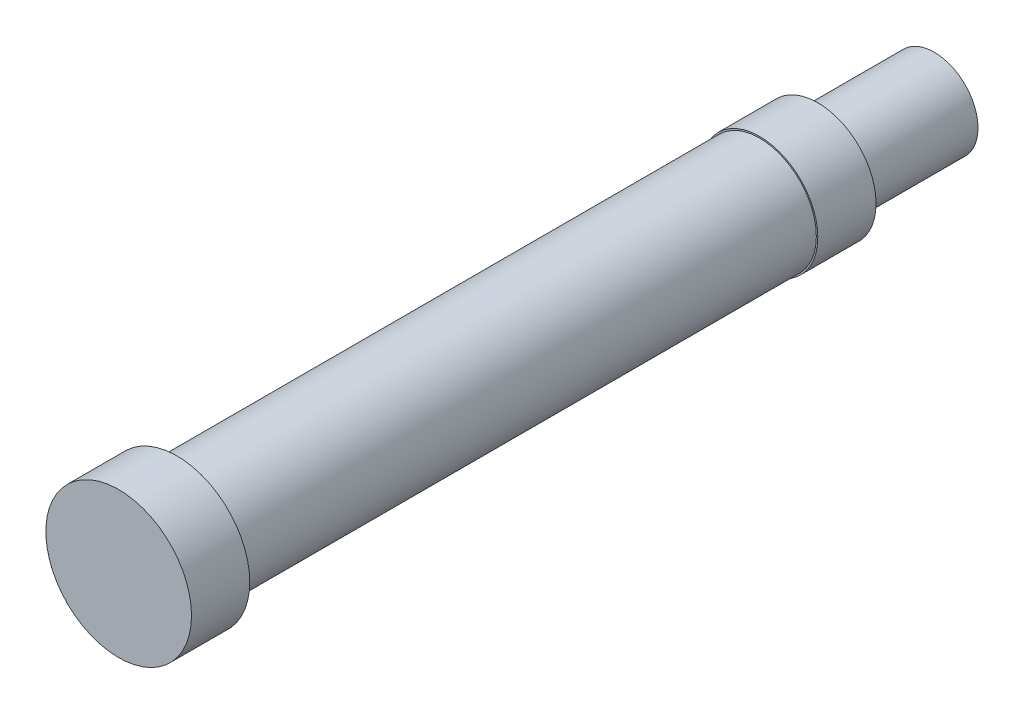
from build123d import *

# Parameters (mm, degrees)
SKETCH1_R           = 1.5
BOSS_EXTRUDE1_DEPTH = 4
SKETCH2_R           = 2
BOSS_EXTRUDE2_DEPTH = 2
SKETCH3_R           = 1.95
BOSS_EXTRUDE3_DEPTH = 20
SKETCH4_R           = 2.5
BOSS_EXTRUDE4_DEPTH = 2


with BuildPart() as part:
    # Sketch1 → Boss-Extrude1 (new body)
    with BuildSketch(Plane.XY):
        Circle(SKETCH1_R)
    extrude(amount=BOSS_EXTRUDE1_DEPTH)

    # Sketch2 → Boss-Extrude2 (add)
    with BuildSketch(Plane.XY.offset(4)):
        Circle(SKETCH2_R)
    extrude(amount=BOSS_EXTRUDE2_DEPTH)

    # Sketch3 → Boss-Extrude3 (add)
    with BuildSketch(Plane.XY.offset(6)):
        Circle(SKETCH3_R)
    extrude(amount=BOSS_EXTRUDE3_DEPTH)

    # Sketch4 → Boss-Extrude4 (add)
    with BuildSketch(Plane.XY.offset(26)):
        Circle(SKETCH4_R)
    extrude(amount=BOSS_EXTRUDE4_DEPTH)


solid = part.part
